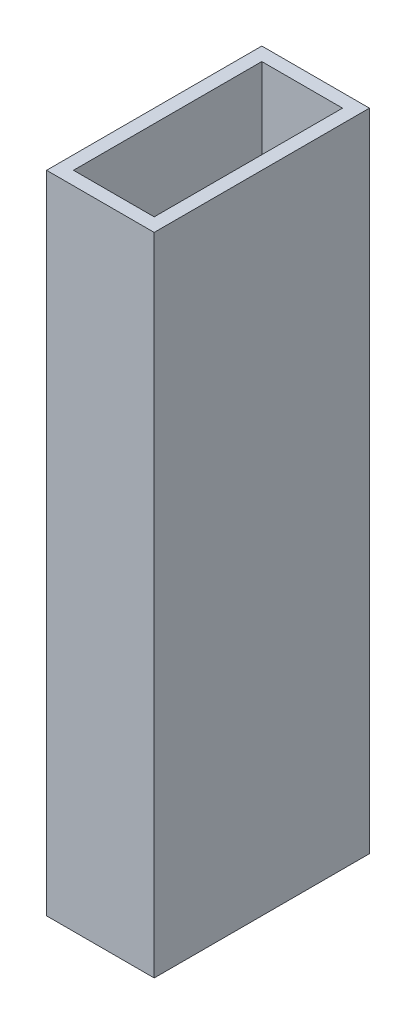
from build123d import *

# Parameters (mm, degrees)
SKETCH1_W           = 25.4
SKETCH1_H           = 50.8
SKETCH1_W_2         = 19.05
SKETCH1_H_2         = 44.45
BOSS_EXTRUDE1_DEPTH = 152.4


with BuildPart() as part:
    # Sketch1 → Boss-Extrude1 (new body)
    with BuildSketch(Plane(origin=(0, 0, 0), x_dir=(1, 0, 0), z_dir=(0, 1, 0))):
        Rectangle(SKETCH1_W, SKETCH1_H)
        Rectangle(SKETCH1_W_2, SKETCH1_H_2, mode=Mode.SUBTRACT)
    extrude(amount=BOSS_EXTRUDE1_DEPTH)


solid = part.part
